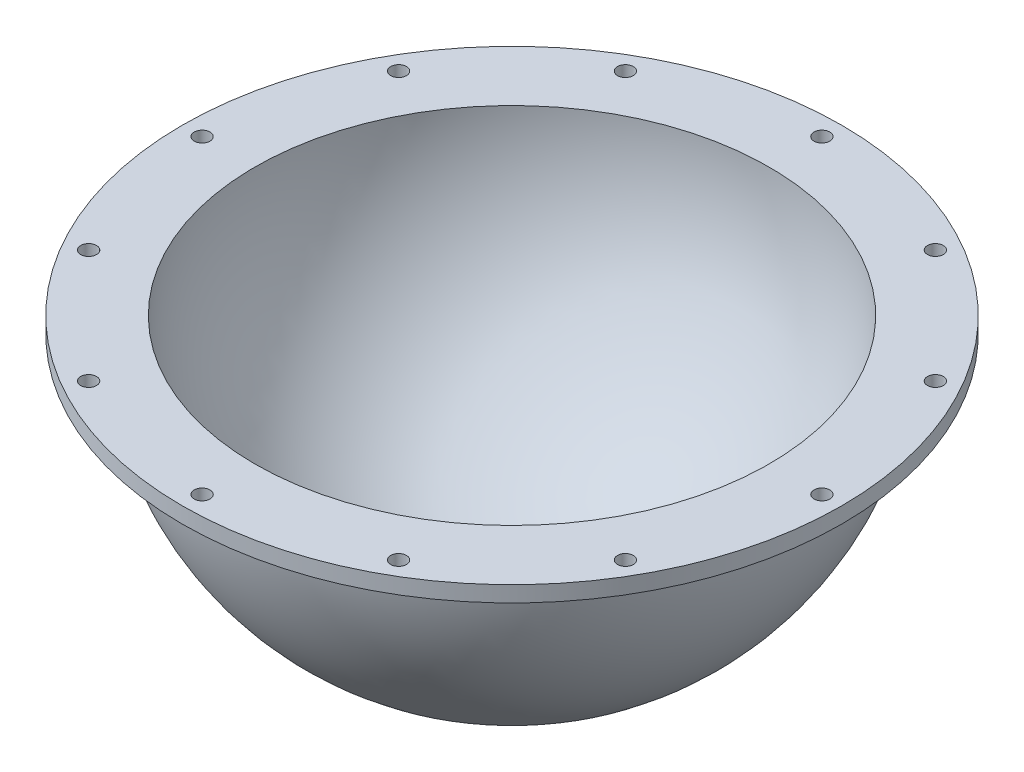
from build123d import *

# Parameters (mm, degrees)
REVOLVE1_ANGLE     = 180
SKETCH10_R         = 6
CUT_EXTRUDE1_DEPTH = 417.413256273


with BuildPart() as part:
    # Sketch1 → Revolve1 (revolve)
    with BuildSketch(Plane(origin=(0, 0, 0), x_dir=(1, 0, 0), z_dir=(0, 1, 0))):
        with BuildLine():
            Line((0, 220), (0, 195))
            ThreePointArc((0, 195), (-195, 0), (0, -195))
            Line((0, -195), (0, -220))
            ThreePointArc((0, -220), (-220, 0), (0, 220))
        make_face()
    revolve(axis=Axis((0, 0, -220), (0, 0, 1)), revolution_arc=REVOLVE1_ANGLE)

    # Sketch3 → Revolve2 (revolve)
    with BuildSketch(Plane(origin=(0, 0, 0), x_dir=(0, 0, -1), z_dir=(1, 0, 0)), mode=Mode.PRIVATE) as revolve2_sk:
        with BuildLine():
            Line((-220, 0), (-250, 0))
            Line((-250, 0), (-250, -12))
            Line((-250, -12), (-219.672483484, -12))
            ThreePointArc((-219.672483484, -12), (-219.918105629, -6.002234315), (-220, 0))
        make_face()
    revolve(revolve2_sk.sketch.rotate(Axis((0, 0, 0), (0, 1, 0)), 180), axis=Axis((0, 0, 0), (0, 1, 0)))

    # Sketch10 → Cut-Extrude1 (cut, through all)
    with BuildSketch(Plane(origin=(0, 0, 0), x_dir=(1, 0, 0), z_dir=(0, 1, 0))):
        with Locations(Location((0, 235, 0), (0, 0, 180))):
            Circle(SKETCH10_R)
        with Locations(Location((-117.5, 203.515969889, 0), (0, 0, 180))):
            Circle(SKETCH10_R)
        with Locations(Location((-203.515969889, 117.5, 0), (0, 0, 180))):
            Circle(SKETCH10_R)
        with Locations(Location((-235, 0, 0), (0, 0, 180))):
            Circle(SKETCH10_R)
        with Locations(Location((-203.515969889, -117.5, 0), (0, 0, 180))):
            Circle(SKETCH10_R)
        with Locations(Location((-117.5, -203.515969889, 0), (0, 0, 180))):
            Circle(SKETCH10_R)
        with Locations(Location((0, -235, 0), (0, 0, 180))):
            Circle(SKETCH10_R)
        with Locations(Location((117.5, -203.515969889, 0), (0, 0, 180))):
            Circle(SKETCH10_R)
        with Locations(Location((203.515969889, -117.5, 0), (0, 0, 180))):
            Circle(SKETCH10_R)
        with Locations(Location((235, 0, 0), (0, 0, 180))):
            Circle(SKETCH10_R)
        with Locations(Location((203.515969889, 117.5, 0), (0, 0, 180))):
            Circle(SKETCH10_R)
        with Locations(Location((117.5, 203.515969889, 0), (0, 0, 180))):
            Circle(SKETCH10_R)
    extrude(amount=-CUT_EXTRUDE1_DEPTH, mode=Mode.SUBTRACT)


solid = part.part
